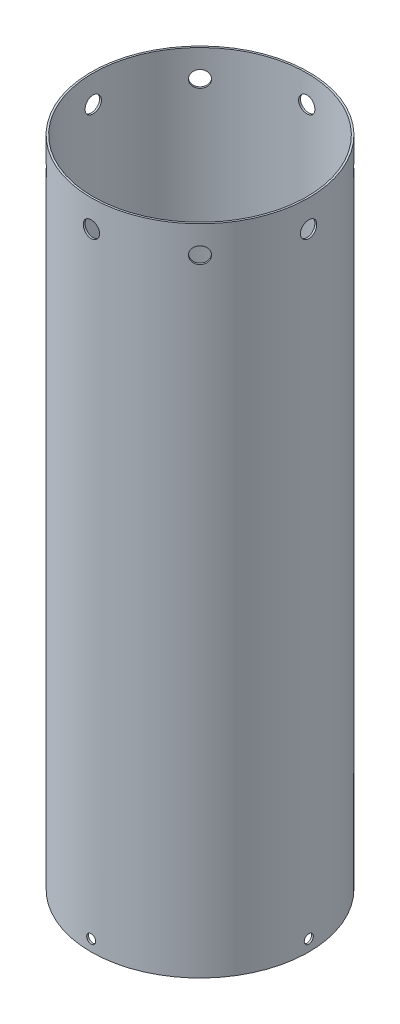
from build123d import *

# Parameters (mm, degrees)
SKETCH1_R           = 76.2
BOSS_EXTRUDE1_DEPTH = 457.2
SKETCH2_R           = 74.93
CUT_EXTRUDE1_DEPTH  = 470.728347026
SKETCH3_R           = 5.715
CUT_EXTRUDE2_DEPTH  = 470.728347026
CIRPATTERN1_COUNT   = 8
SKETCH4_R           = 3.175
CUT_EXTRUDE3_DEPTH  = 470.728347157
CIRPATTERN2_COUNT   = 4


with BuildPart() as part:
    # Sketch1 → Boss-Extrude1 (new body)
    with BuildSketch(Plane(origin=(0, 0, 0), x_dir=(1, 0, 0), z_dir=(0, 1, 0))):
        with Locations(Location((0, 0, 0), (0, 0, 270))):
            Circle(SKETCH1_R)
    extrude(amount=BOSS_EXTRUDE1_DEPTH)

    # Sketch2 → Cut-Extrude1 (cut, through all)
    with BuildSketch(Plane(origin=(0, 457.2, 0), x_dir=(1, 0, 0), z_dir=(0, 1, 0))):
        with Locations(Location((0, 0, 0), (0, 0, 270))):
            Circle(SKETCH2_R)
    extrude(amount=-CUT_EXTRUDE1_DEPTH, mode=Mode.SUBTRACT)

    # Sketch3 → Cut-Extrude2 (cut, symmetric)
    with BuildSketch(Plane.XY):
        with Locations((0, 438.15)):
            Circle(SKETCH3_R)
    cut_extrude2 = extrude(amount=CUT_EXTRUDE2_DEPTH, both=True, mode=Mode.SUBTRACT)

    # CirPattern1: Cut-Extrude2 ×8 about axis
    cirpattern1_axis = Axis((0, 457.2, 0), (0, -1, 0))
    for i in range(1, CIRPATTERN1_COUNT):
        add(cut_extrude2.rotate(cirpattern1_axis, i * 360 / CIRPATTERN1_COUNT), mode=Mode.SUBTRACT)

    # Sketch4 → Cut-Extrude3 (cut, symmetric)
    with BuildSketch(Plane.XY):
        with Locations((0, 7.9375)):
            Circle(SKETCH4_R)
    cut_extrude3 = extrude(amount=CUT_EXTRUDE3_DEPTH, both=True, mode=Mode.SUBTRACT)

    # CirPattern2: Cut-Extrude3 ×4 about axis
    cirpattern2_axis = Axis((0, 457.2, 0), (0, -1, 0))
    for i in range(1, CIRPATTERN2_COUNT):
        add(cut_extrude3.rotate(cirpattern2_axis, i * 360 / CIRPATTERN2_COUNT), mode=Mode.SUBTRACT)


solid = part.part
